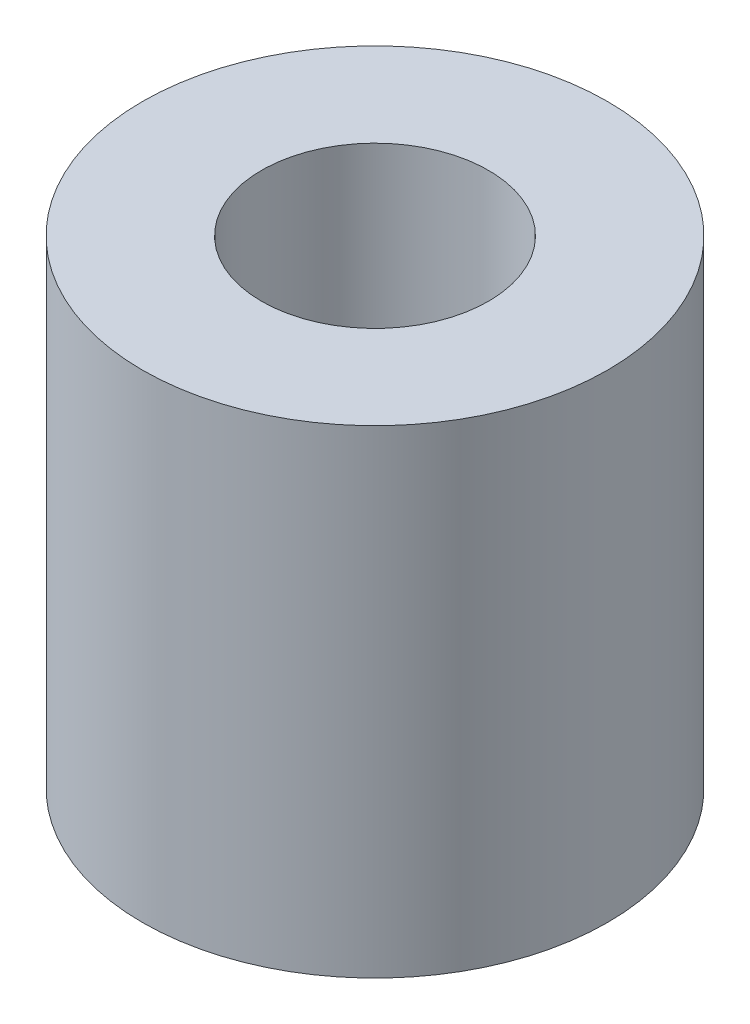
from build123d import *

# Parameters (mm, degrees)
SKETCH1_R           = 12.35
SKETCH1_R_2         = 6.025
BOSS_EXTRUDE1_DEPTH = 25.4


with BuildPart() as part:
    # Sketch1 → Boss-Extrude1 (new body)
    with BuildSketch(Plane(origin=(0, 0, 0), x_dir=(1, 0, 0), z_dir=(0, 1, 0))):
        with Locations(Location((0, 0, 0), (0, 0, 270))):
            Circle(SKETCH1_R)
        with Locations(Location((0, 0, 0), (0, 0, 270))):
            Circle(SKETCH1_R_2, mode=Mode.SUBTRACT)
    extrude(amount=BOSS_EXTRUDE1_DEPTH)


solid = part.part
